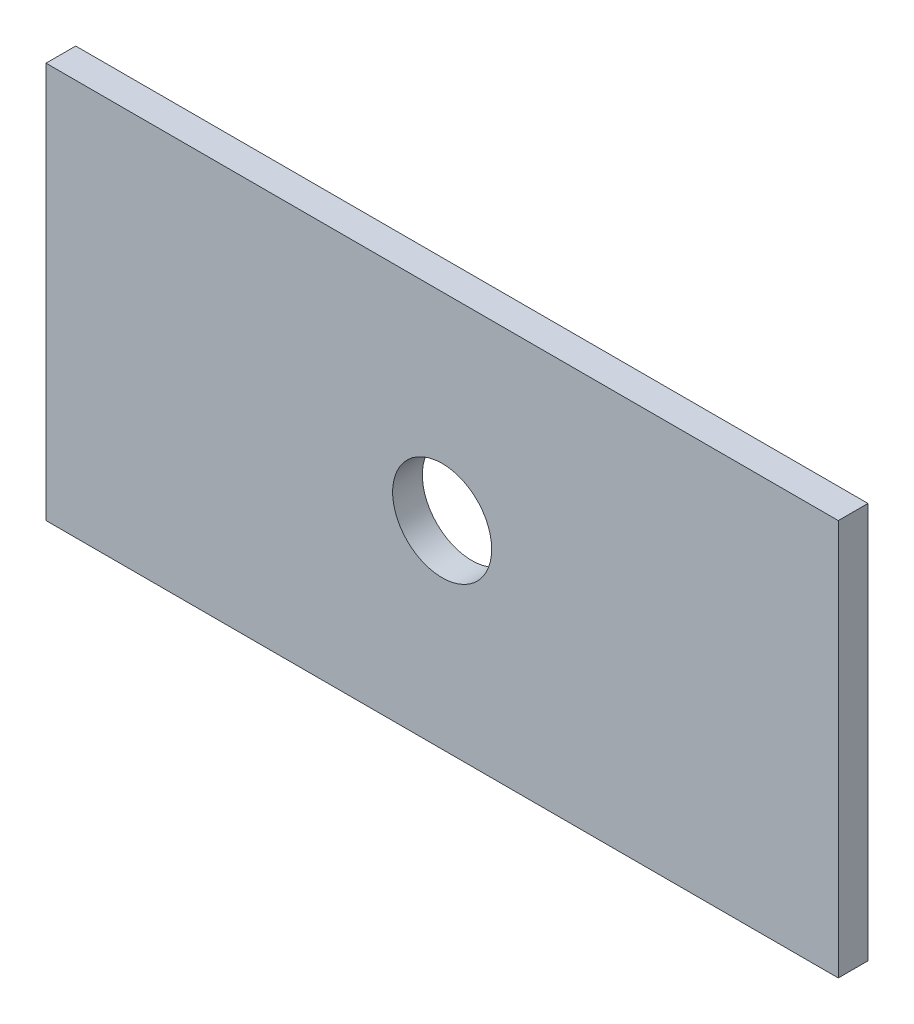
from build123d import *

# Parameters (mm, degrees)
SKETCH_1_W      = 80
SKETCH_1_H      = 40
SKETCH_1_R      = 5
EXTRUDE_1_DEPTH = 3


with BuildPart() as part:
    # 草图1 → 凸台-拉伸1 (new body)
    with BuildSketch(Plane.XY):
        with Locations((-19.796949109, 6.093138535)):
            Rectangle(SKETCH_1_W, SKETCH_1_H)
        with Locations((-19.796949109, 6.093138535)):
            Circle(SKETCH_1_R, mode=Mode.SUBTRACT)
    extrude(amount=EXTRUDE_1_DEPTH)


solid = part.part
